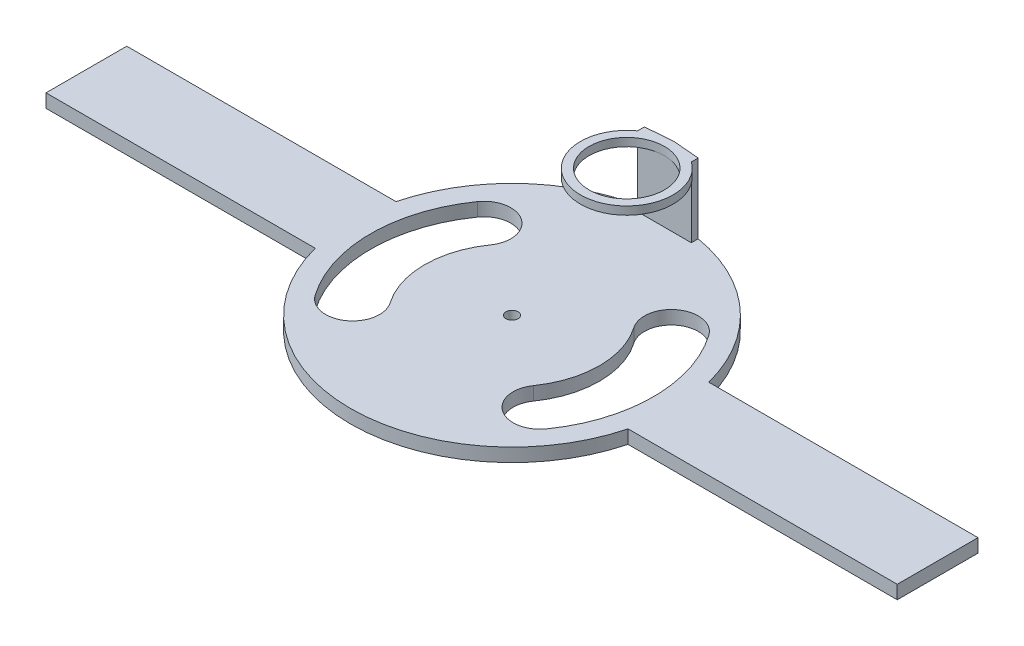
from build123d import *

# Parameters (mm, degrees)
SKETCH1_R           = 60
BOSS_EXTRUDE1_DEPTH = 5
CUT_EXTRUDE1_DEPTH  = 5
BOSS_EXTRUDE2_DEPTH = 23
SKETCH4_R           = 2.25
CUT_EXTRUDE2_DEPTH  = 15
BOSS_EXTRUDE3_START = -5
BOSS_EXTRUDE3_DEPTH = 5
SKETCH10_R          = 14
BOSS_EXTRUDE6_DEPTH = 3


with BuildPart() as part:
    # Sketch1 → Boss-Extrude1 (new body)
    with BuildSketch(Plane(origin=(0, 0, 0), x_dir=(1, 0, 0), z_dir=(0, 1, 0))):
        with Locations(Location((0, 0, 0), (0, 0, 270))):
            Circle(SKETCH1_R)
    extrude(amount=BOSS_EXTRUDE1_DEPTH)

    # Sketch2 → Cut-Extrude1 (cut)
    with BuildSketch(Plane(origin=(0, 5, 0), x_dir=(1, 0, 0), z_dir=(0, 1, 0))):
        with BuildLine():
            ThreePointArc((-43.005482325, 30.112762908), (-52.5, 0), (-43.005482325, -30.112762908))
            ThreePointArc((-43.005482325, -30.112762908), (-29.078197519, -32.568518988), (-26.622441439, -18.641234181))
            ThreePointArc((-26.622441439, -18.641234181), (-32.5, 0), (-26.622441439, 18.641234181))
            ThreePointArc((-26.622441439, 18.641234181), (-29.078197519, 32.568518988), (-43.005482325, 30.112762908))
        make_face()
        with BuildLine():
            ThreePointArc((43.005482325, 30.112762908), (29.078197519, 32.568518988), (26.622441439, 18.641234181))
            ThreePointArc((26.622441439, 18.641234181), (32.5, 0), (26.622441439, -18.641234181))
            ThreePointArc((26.622441439, -18.641234181), (29.078197519, -32.568518988), (43.005482325, -30.112762908))
            ThreePointArc((43.005482325, -30.112762908), (52.5, 0), (43.005482325, 30.112762908))
        make_face()
    extrude(amount=-CUT_EXTRUDE1_DEPTH, mode=Mode.SUBTRACT)

    # Sketch3 → Boss-Extrude2 (add)
    with BuildSketch(Plane(origin=(0, 5, 0), x_dir=(1, 0, 0), z_dir=(0, 1, 0))):
        with BuildLine():
            Line((10, 56.623758265), (10, 59.160797831))
            ThreePointArc((10, 59.160797831), (0, 60), (-10, 59.160797831))
            Line((-10, 59.160797831), (-10, 56.623758265))
            Line((-10, 56.623758265), (10, 56.623758265))
        make_face()
    extrude(amount=BOSS_EXTRUDE2_DEPTH)

    # Sketch4 → Cut-Extrude2 (cut)
    with BuildSketch(Plane(origin=(0, 5, 0), x_dir=(1, 0, 0), z_dir=(0, 1, 0))):
        with Locations(Location((0, 0, 0), (0, 0, 270))):
            Circle(SKETCH4_R)
    extrude(amount=-CUT_EXTRUDE2_DEPTH, mode=Mode.SUBTRACT)

    # Sketch5 → Boss-Extrude3 (add)
    with BuildSketch(Plane(origin=(0, 5, 0), x_dir=(1, 0, 0), z_dir=(0, 1, 0)).offset(BOSS_EXTRUDE3_START)):
        with BuildLine():
            Line((-58.094750193, 15), (-158.094750193, 15))
            Line((-158.094750193, 15), (-158.094750193, -15))
            Line((-158.094750193, -15), (-58.094750193, -15))
            ThreePointArc((-58.094750193, -15), (-60, 0), (-58.094750193, 15))
        make_face()
    boss_extrude3 = extrude(amount=BOSS_EXTRUDE3_DEPTH)

    # Mirror1: Boss-Extrude3 across plane
    add(boss_extrude3.mirror(Plane(origin=(0, 0, 0), x_dir=(0, 0, 1), z_dir=(1, 0, 0))))

    # Sketch10 → Boss-Extrude6 (add)
    with BuildSketch(Plane(origin=(0, 28, 0), x_dir=(1, 0, 0), z_dir=(0, 1, 0))):
        with BuildLine():
            Line((-10, 59.160797831), (-10, 56.623758265))
            ThreePointArc((-10, 56.623758265), (0, 25.41910773), (10, 56.623758265))
            Line((10, 56.623758265), (10, 59.160797831))
            Line((10, 59.160797831), (0, 60))
            Line((0, 60), (-10, 59.160797831))
        make_face()
        with Locations(Location((0, 42.623758265, 0), (0, 0, 90))):
            Circle(SKETCH10_R, mode=Mode.SUBTRACT)
    extrude(amount=BOSS_EXTRUDE6_DEPTH)


solid = part.part
